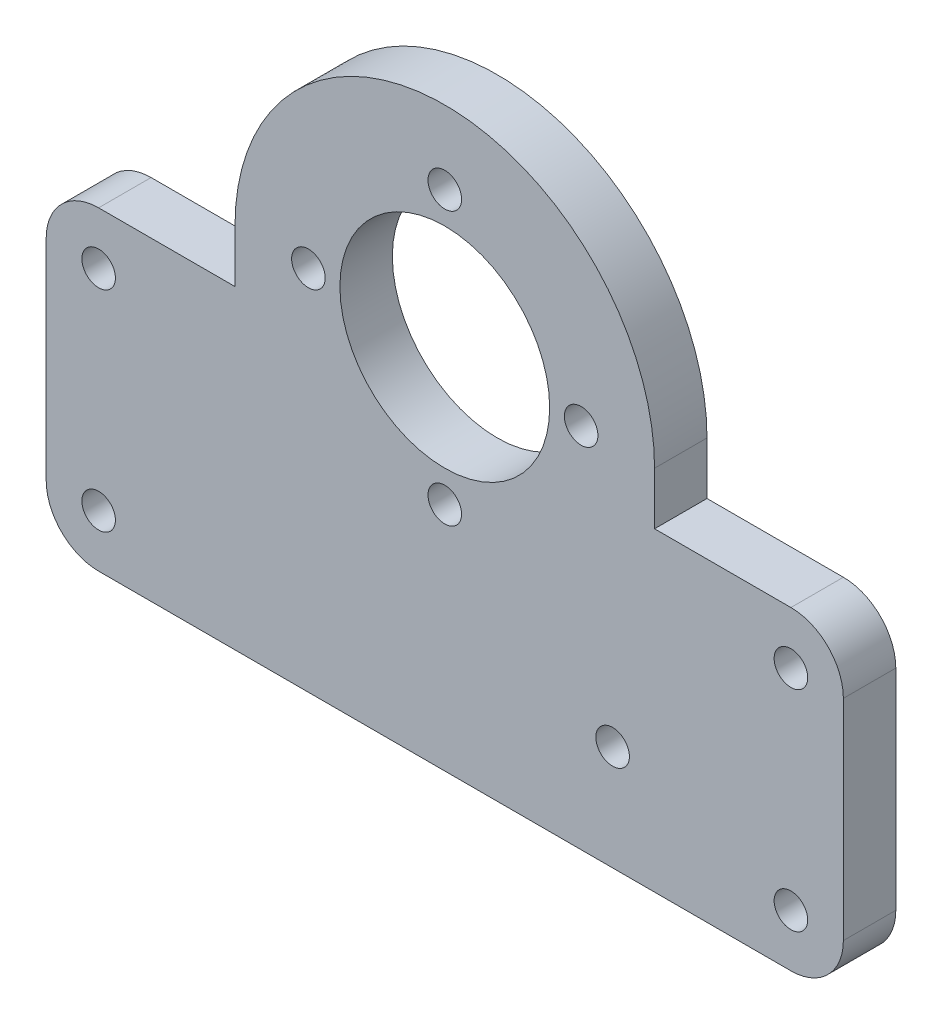
from build123d import *

# Parameters (mm, degrees)
SKETCH_1_W           = 76
SKETCH_1_H           = 60
EXTRUDE_1_DEPTH      = 5
FILLET_1_R           = 5
SKETCH_4_R           = 1.6
CUT_EXTRUDE_3_DEPTH  = 5
SKETCH_11_R          = 10
SKETCH_11_R_2        = 1.6
CUT_EXTRUDE_11_DEPTH = 10
CUT_EXTRUDE_12_DEPTH = 13.5
FILLET_2_R           = 5
SKETCH_13_R          = 1.6
CUT_EXTRUDE_13_DEPTH = 49.672374095


with BuildPart() as part:
    # ｽｹｯﾁ1 → ﾎﾞｽ - 押し出し1 (new body)
    with BuildSketch(Plane.XY):
        Rectangle(SKETCH_1_W, SKETCH_1_H)
    extrude(amount=EXTRUDE_1_DEPTH)

    # ﾌｨﾚｯﾄ1
    fillet_1_edges = [part.edges().sort_by_distance(p)[0] for p in [
        (38, -30, 2.5),
        (-38, -30, 2.5),
        (-38, 30, 2.5),
        (38, 30, 2.5),
    ]]
    fillet(fillet_1_edges, radius=FILLET_1_R)

    # ｽｹｯﾁ4 → ｶｯﾄ - 押し出し3 (cut)
    with BuildSketch(Plane(origin=(0, 0, 0), x_dir=(-1, 0, 0), z_dir=(0, 0, -1))):
        with Locations((-33, -5)):
            Circle(SKETCH_4_R)
        with Locations((-33, -25)):
            Circle(SKETCH_4_R)
        with Locations((33, -5)):
            Circle(SKETCH_4_R)
        with Locations((33, -25)):
            Circle(SKETCH_4_R)
    extrude(amount=-CUT_EXTRUDE_3_DEPTH, mode=Mode.SUBTRACT)

    # ｽｹｯﾁ11 → ｶｯﾄ - 押し出し11 (cut)
    with BuildSketch(Plane(origin=(0, 0, 0), x_dir=(-1, 0, 0), z_dir=(0, 0, -1))):
        with Locations((0, 5)):
            Circle(SKETCH_11_R)
        with Locations((0, 18)):
            Circle(SKETCH_11_R_2)
        with Locations((13, 5)):
            Circle(SKETCH_11_R_2)
        with Locations((0, -8)):
            Circle(SKETCH_11_R_2)
        with Locations((-13, 5)):
            Circle(SKETCH_11_R_2)
    extrude(amount=-CUT_EXTRUDE_11_DEPTH, mode=Mode.SUBTRACT)

    # ｽｹｯﾁ12 → ｶｯﾄ - 押し出し12 (cut)
    with BuildSketch(Plane(origin=(0, 0, 0), x_dir=(-1, 0, 0), z_dir=(0, 0, -1))):
        with BuildLine():
            Line((-38, 0), (-20, 0))
            Line((-20, 0), (-20, 5))
            ThreePointArc((-20, 5), (0, 25), (20, 5))
            Line((20, 5), (20, 0))
            Line((20, 0), (38, 0))
            Line((38, 0), (38, 30))
            Line((38, 30), (-38, 30))
            Line((-38, 30), (-38, 0))
        make_face()
    extrude(amount=-CUT_EXTRUDE_12_DEPTH, mode=Mode.SUBTRACT)

    # ﾌｨﾚｯﾄ2
    fillet_2_edges = [part.edges().sort_by_distance(p)[0] for p in [
        (-38, 0, 2.5),
        (38, 0, 2.5),
    ]]
    fillet(fillet_2_edges, radius=FILLET_2_R)

    # ｽｹｯﾁ13 → ｶｯﾄ - 押し出し13 (cut, through all)
    with BuildSketch(Plane.XY.offset(5)):
        with Locations((16, -20)):
            Circle(SKETCH_13_R)
    extrude(amount=-CUT_EXTRUDE_13_DEPTH, mode=Mode.SUBTRACT)


solid = part.part
